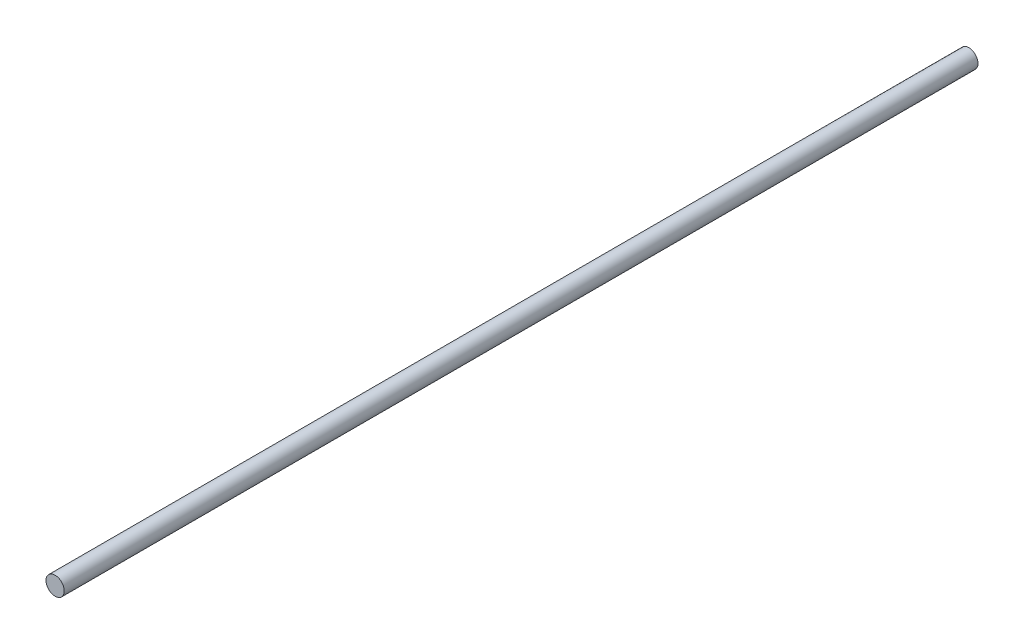
from build123d import *

# Parameters (mm, degrees)
CROQUIS1_R              = 0.5
SALIENTE_EXTRUIR1_DEPTH = 50


with BuildPart() as part:
    # Croquis1 → Saliente-Extruir1 (new body)
    with BuildSketch(Plane.XY):
        Circle(CROQUIS1_R)
    extrude(amount=SALIENTE_EXTRUIR1_DEPTH)


solid = part.part
